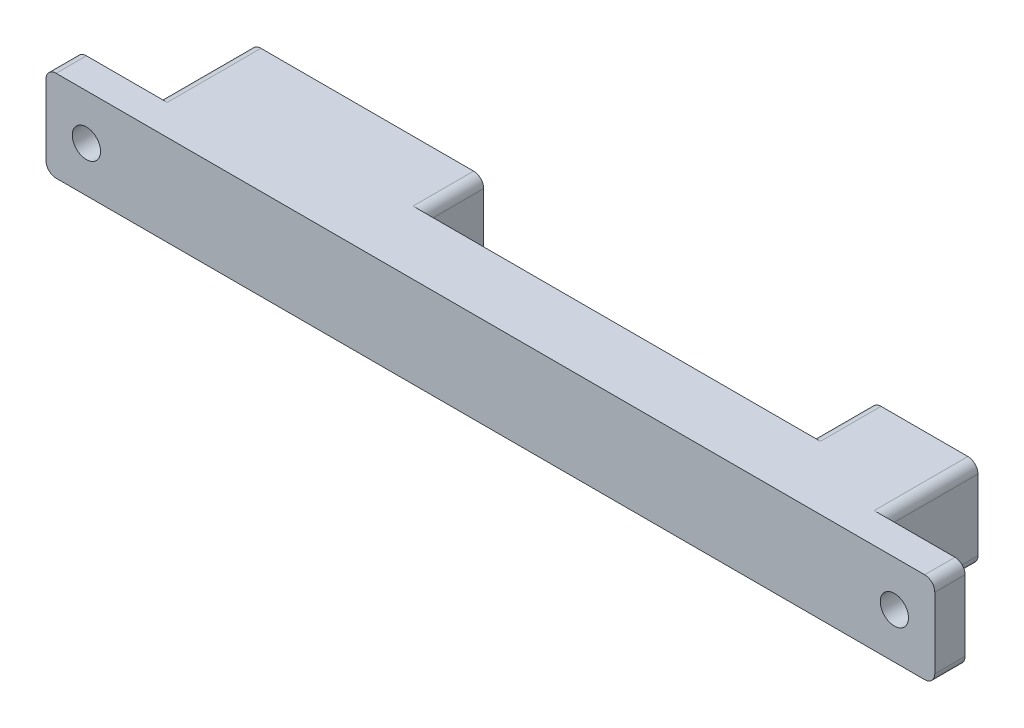
from build123d import *

# Parameters (mm, degrees)
SKETCH1_R           = 1.8
BOSS_EXTRUDE1_DEPTH = 12.28
CUT_EXTRUDE1_DEPTH  = 6
SKETCH1_4_R         = 1.8
CUT_EXTRUDE2_DEPTH  = 8
SKETCH2_W           = 8
SKETCH2_H           = 9
SKETCH2_R           = 1.4
BOSS_EXTRUDE2_DEPTH = 3
FILLET1_R           = 1
CHAMFER1_SIZE       = 0.5


with BuildPart() as part:
    # Sketch1 → Boss-Extrude1 (new body)
    # profile 1 of 5: a face of its own
    with BuildSketch(Plane.XY):
        Polygon((36, 28.4), (25.4, 28.4), (25.4, 27.4), (25.4, 20.4), (25.4, 19.4), (36, 19.4), align=None)
        with Locations((32, 23.9)):
            Circle(SKETCH1_R, mode=Mode.SUBTRACT)
    # profile 2 of 5: a face of its own
    with BuildSketch(Plane.XY):
        with Locations((32, 23.9)):
            Circle(SKETCH1_R)
    # profile 3 of 5: a face of its own
    with BuildSketch(Plane.XY):
        Polygon((-12.94, 28.4), (-36, 28.4), (-36, 19.4), (-12.94, 19.4), (-12.94, 20.4), (-12.94, 27.4), align=None)
        with Locations((-32, 23.9)):
            Circle(SKETCH1_R, mode=Mode.SUBTRACT)
    # profile 4 of 5: a face of its own
    with BuildSketch(Plane.XY):
        with Locations((-32, 23.9)):
            Circle(SKETCH1_R)
    # profile 5 of 5: a face of its own
    with BuildSketch(Plane.XY):
        Polygon((25.4, 28.4), (-12.94, 28.4), (-12.94, 27.4), (-12.94, 20.4), (-12.94, 19.4), (25.4, 19.4), (25.4, 20.4), (25.4, 27.4), align=None)
    extrude(amount=BOSS_EXTRUDE1_DEPTH)

    # Sketch1<3> → Cut-Extrude1 (cut)
    with BuildSketch(Plane.XY):
        Polygon((25.4, 28.4), (-12.94, 28.4), (-12.94, 27.4), (-12.94, 20.4), (-12.94, 19.4), (25.4, 19.4), (25.4, 20.4), (25.4, 27.4), align=None)
    extrude(amount=CUT_EXTRUDE1_DEPTH, mode=Mode.SUBTRACT)

    # Sketch1<4> → Cut-Extrude2 (cut)
    with BuildSketch(Plane.XY):
        with Locations((-32, 23.9)):
            Circle(SKETCH1_4_R)
        with Locations((32, 23.9)):
            Circle(SKETCH1_4_R)
    extrude(amount=CUT_EXTRUDE2_DEPTH, mode=Mode.SUBTRACT)

    # Sketch2 → Boss-Extrude2 (add)
    # profile 1 of 2: a face of its own
    with BuildSketch(Plane.XY.offset(12.28)):
        with Locations((-40, 23.9)):
            Rectangle(SKETCH2_W, SKETCH2_H)
        with Locations((-40, 23.9)):
            Circle(SKETCH2_R, mode=Mode.SUBTRACT)
    # profile 2 of 2: a face of its own
    with BuildSketch(Plane.XY.offset(12.28)):
        with Locations((40, 23.9)):
            Rectangle(SKETCH2_W, SKETCH2_H)
        with Locations((40, 23.9)):
            Circle(SKETCH2_R, mode=Mode.SUBTRACT)
    extrude(amount=-BOSS_EXTRUDE2_DEPTH)

    # Fillet1
    fillet1_edges = [part.edges().sort_by_distance(p)[0] for p in [
        (-12.94, 19.4, 3),
        (25.4, 19.4, 3),
        (25.4, 28.4, 3),
        (-12.94, 28.4, 3),
        (-36, 28.4, 4.64),
        (-36, 19.4, 4.64),
        (36, 28.4, 4.64),
        (36, 19.4, 4.64),
        (-44, 19.4, 10.78),
        (-44, 28.4, 10.78),
        (44, 19.4, 10.78),
        (44, 28.4, 10.78),
    ]]
    fillet(fillet1_edges, radius=FILLET1_R)

    # Chamfer1
    chamfer1_edges = [part.edges().sort_by_distance(p)[0] for p in [
        (-33.8, 23.9, 0),
        (30.2, 23.9, 0),
    ]]
    chamfer(chamfer1_edges, length=CHAMFER1_SIZE)


solid = part.part
